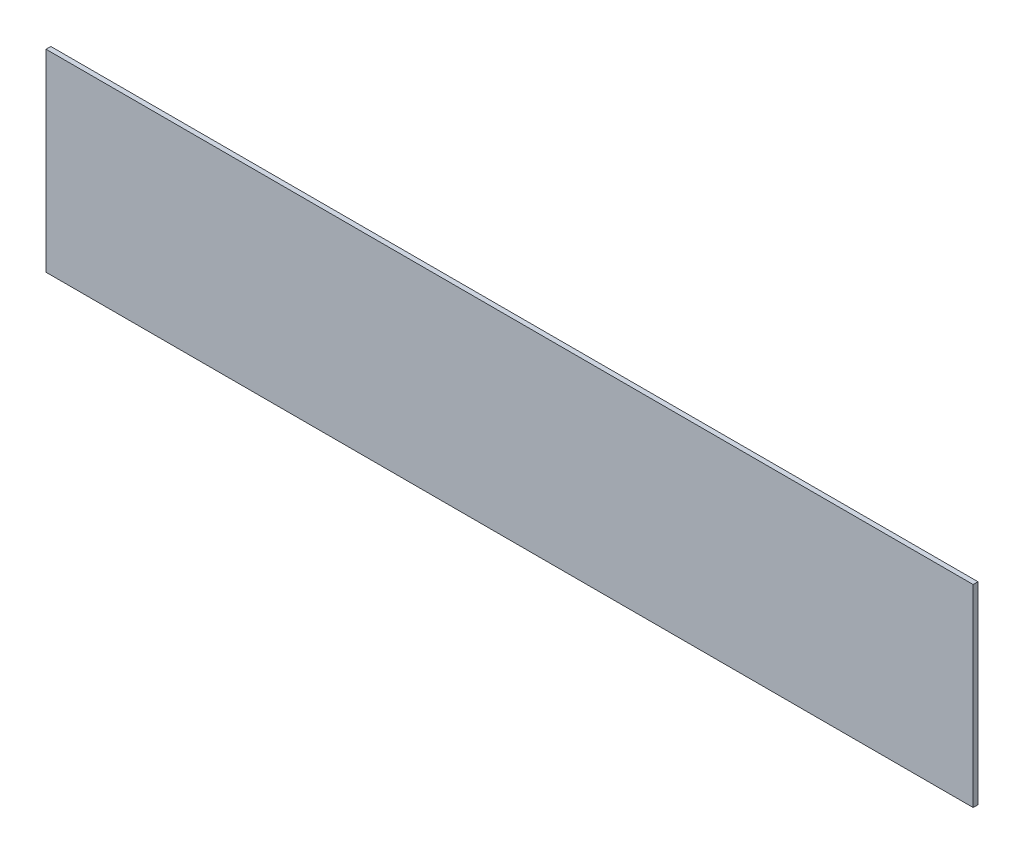
from build123d import *

# Parameters (mm, degrees)
SKETCH1_W           = 2438.4
SKETCH1_H           = 508
BOSS_EXTRUDE1_DEPTH = 12.7


with BuildPart() as part:
    # Sketch1 → Boss-Extrude1 (new body)
    with BuildSketch(Plane.XY):
        with Locations((1219.2, 254)):
            Rectangle(SKETCH1_W, SKETCH1_H)
    extrude(amount=BOSS_EXTRUDE1_DEPTH)


solid = part.part
